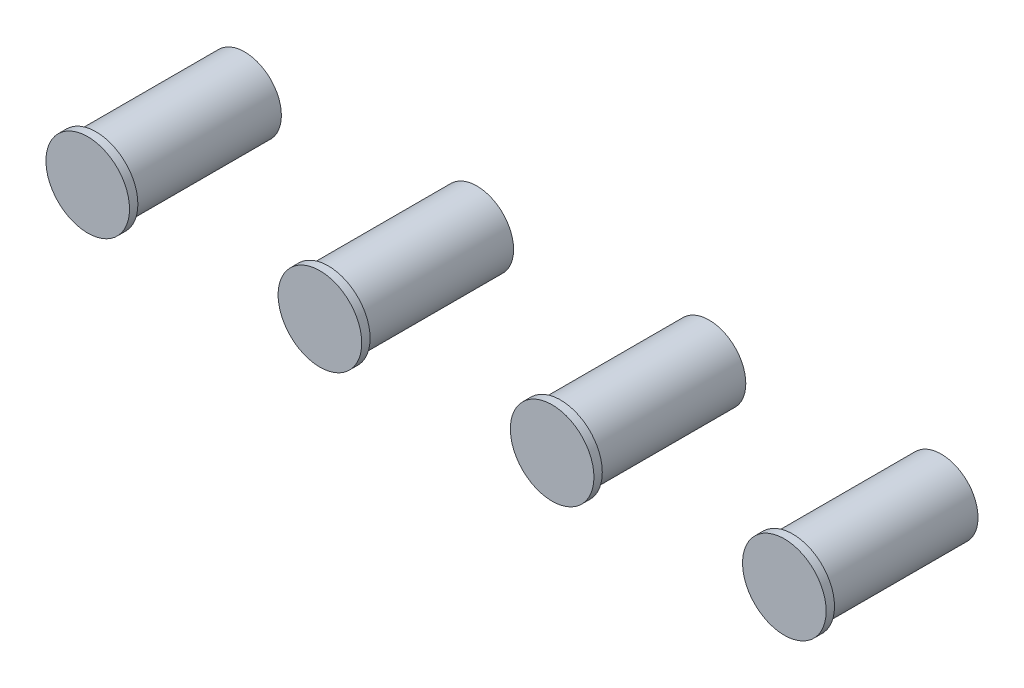
from build123d import *

# Parameters (mm, degrees)
V09_16MM_SWITCH_BODIES_TAIL_ALLOWANCE32_START = -32
SKETCH_3_R                                    = 7.9
V09_16MM_SWITCH_BODIES_TAIL_ALLOWANCE32_DEPTH = 32
V09_16MM_SWITCH_BODIES_TAIL_ALLOWANC_START    = -32
V09_16MM_SWITCH_BODIES_TAIL_ALLOWANC_2_DEPTH  = 32
V09_16MM_SWITCH_BODIES_TAIL_ALLOWANC_3_DEPTH  = 32
V09_16MM_SWITCH_BODIES_TAIL_ALLOWANC_4_DEPTH  = 32
SKETCH_4_R                                    = 9
V09_SWITCH_FLANGE_D18_DEPTH                   = 1.8


with BuildPart() as part:
    # 草图3 → V09_16mm_switch_bodies_tail_allowance32 (new body)
    with BuildSketch(Plane.XY.offset(V09_16MM_SWITCH_BODIES_TAIL_ALLOWANCE32_START)):
        with Locations((-75, 110)):
            Circle(SKETCH_3_R)
    extrude(amount=V09_16MM_SWITCH_BODIES_TAIL_ALLOWANCE32_DEPTH)



with BuildPart() as body_2:
    # 草图3 → V09_16mm_switch_bodies_tail_allowanc 2 (new body)
    with BuildSketch(Plane.XY.offset(V09_16MM_SWITCH_BODIES_TAIL_ALLOWANC_START)):
        with Locations((-25, 110)):
            Circle(SKETCH_3_R)
    extrude(amount=V09_16MM_SWITCH_BODIES_TAIL_ALLOWANC_2_DEPTH)


with BuildPart() as body_3:
    # 草图3 → V09_16mm_switch_bodies_tail_allowanc 3 (new body)
    with BuildSketch(Plane.XY.offset(V09_16MM_SWITCH_BODIES_TAIL_ALLOWANC_START)):
        with Locations((25, 110)):
            Circle(SKETCH_3_R)
    extrude(amount=V09_16MM_SWITCH_BODIES_TAIL_ALLOWANC_3_DEPTH)


with BuildPart() as body_4:
    # 草图3 → V09_16mm_switch_bodies_tail_allowanc 4 (new body)
    with BuildSketch(Plane.XY.offset(V09_16MM_SWITCH_BODIES_TAIL_ALLOWANC_START)):
        with Locations((75, 110)):
            Circle(SKETCH_3_R)
    extrude(amount=V09_16MM_SWITCH_BODIES_TAIL_ALLOWANC_4_DEPTH)


with BuildPart() as part_1:
    add(part.part)

    add(body_2.part)  # V09_Switch_flange_D18 merges body 2

    add(body_3.part)  # V09_Switch_flange_D18 merges body 3

    add(body_4.part)  # V09_Switch_flange_D18 merges body 4
    # 草图4 → V09_Switch_flange_D18 (add)
    with BuildSketch(Plane.XY):
        with Locations((-75, 110)):
            Circle(SKETCH_4_R)
        with Locations((-25, 110)):
            Circle(SKETCH_4_R)
        with Locations((25, 110)):
            Circle(SKETCH_4_R)
        with Locations((75, 110)):
            Circle(SKETCH_4_R)
    extrude(amount=V09_SWITCH_FLANGE_D18_DEPTH)


solid = part_1.part
